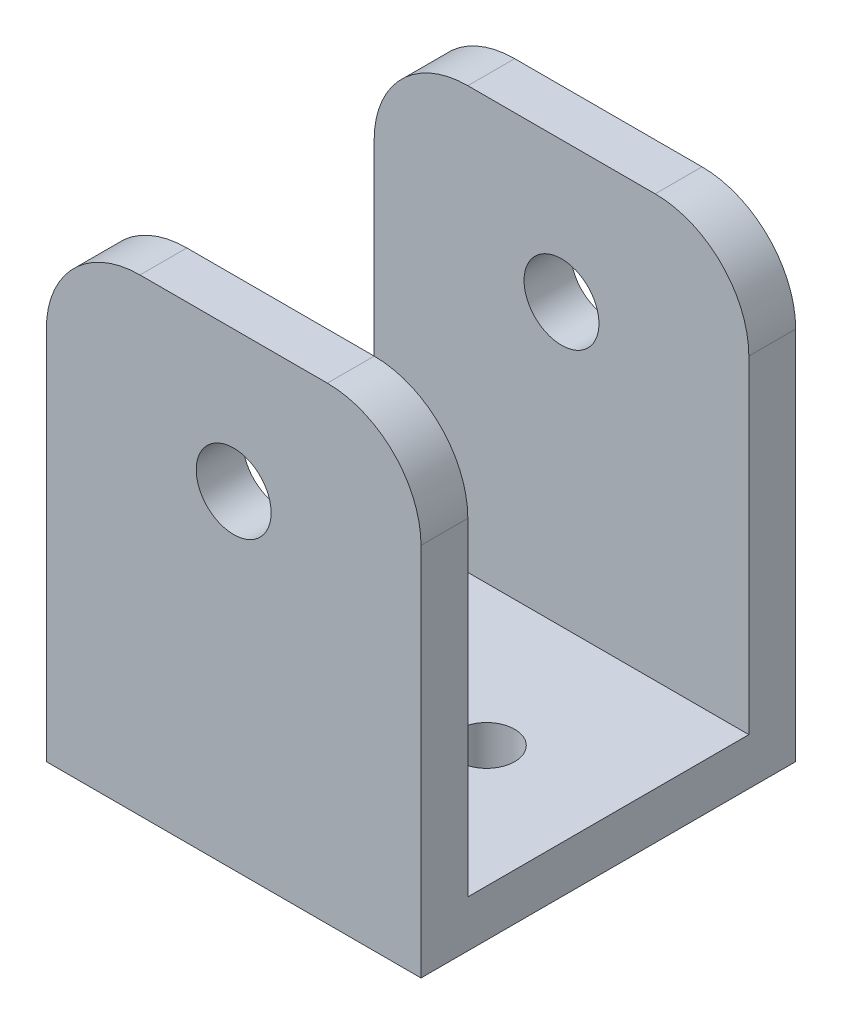
from build123d import *

# Parameters (mm, degrees)
SKETCH1_R           = 4
BOSS_EXTRUDE4_DEPTH = 5
SKETCH4_W           = 40
SKETCH4_H           = 5
BOSS_EXTRUDE5_DEPTH = 30
BOSS_EXTRUDE6_START = 5
SKETCH5_W           = 40
SKETCH5_H           = 5
SKETCH5_R           = 4
BOSS_EXTRUDE6_DEPTH = 5
SKETCH7_R           = 3
CUT_EXTRUDE1_DEPTH  = 15


with BuildPart() as part:
    # Sketch1 → Boss-Extrude4 (new body)
    with BuildSketch(Plane.XY):
        with BuildLine():
            Line((-20, -35), (20, -35))
            Line((20, -35), (20, 5))
            ThreePointArc((20, 5), (17.071067812, 12.071067812), (10, 15))
            Line((10, 15), (-10, 15))
            ThreePointArc((-10, 15), (-17.071067812, 12.071067812), (-20, 5))
            Line((-20, 5), (-20, -35))
        make_face()
        Circle(SKETCH1_R, mode=Mode.SUBTRACT)
    extrude(amount=BOSS_EXTRUDE4_DEPTH)

    # Sketch4 → Boss-Extrude5 (add)
    with BuildSketch(Plane(origin=(0, 0, 0), x_dir=(-1, 0, 0), z_dir=(0, 0, -1))):
        with Locations((0, -32.5)):
            Rectangle(SKETCH4_W, SKETCH4_H)
    extrude(amount=BOSS_EXTRUDE5_DEPTH)

    # Sketch5 → Boss-Extrude6 (add)
    # profile 1 of 2: a face of its own
    with BuildSketch(Plane(origin=(0, 0, -30), x_dir=(-1, 0, 0), z_dir=(0, 0, -1)).offset(BOSS_EXTRUDE6_START)):
        with Locations((0, -32.5)):
            Rectangle(SKETCH5_W, SKETCH5_H)
    # profile 2 of 2: a face of its own
    with BuildSketch(Plane(origin=(0, 0, -30), x_dir=(-1, 0, 0), z_dir=(0, 0, -1)).offset(BOSS_EXTRUDE6_START)):
        with BuildLine():
            Line((-20, 0), (-20, -30))
            Line((-20, -30), (20, -30))
            Line((20, -30), (20, 0))
            Line((20, 0), (20, 5))
            ThreePointArc((20, 5), (17.071067812, 12.071067812), (10, 15))
            Line((10, 15), (-10, 15))
            ThreePointArc((-10, 15), (-17.071067812, 12.071067812), (-20, 5))
            Line((-20, 5), (-20, 0))
        make_face()
        with Locations(Location((0, 0, 0), (0, 0, 180))):
            Circle(SKETCH5_R, mode=Mode.SUBTRACT)
    extrude(amount=-BOSS_EXTRUDE6_DEPTH)

    # Sketch7 → Cut-Extrude1 (cut)
    with BuildSketch(Plane(origin=(0, -30, 0), x_dir=(1, 0, 0), z_dir=(0, 1, 0))):
        with Locations(Location((-7, 15, 0), (0, 0, 270))):
            Circle(SKETCH7_R)
        with Locations(Location((7, 15, 0), (0, 0, 270))):
            Circle(SKETCH7_R)
    extrude(amount=-CUT_EXTRUDE1_DEPTH, mode=Mode.SUBTRACT)


solid = part.part
